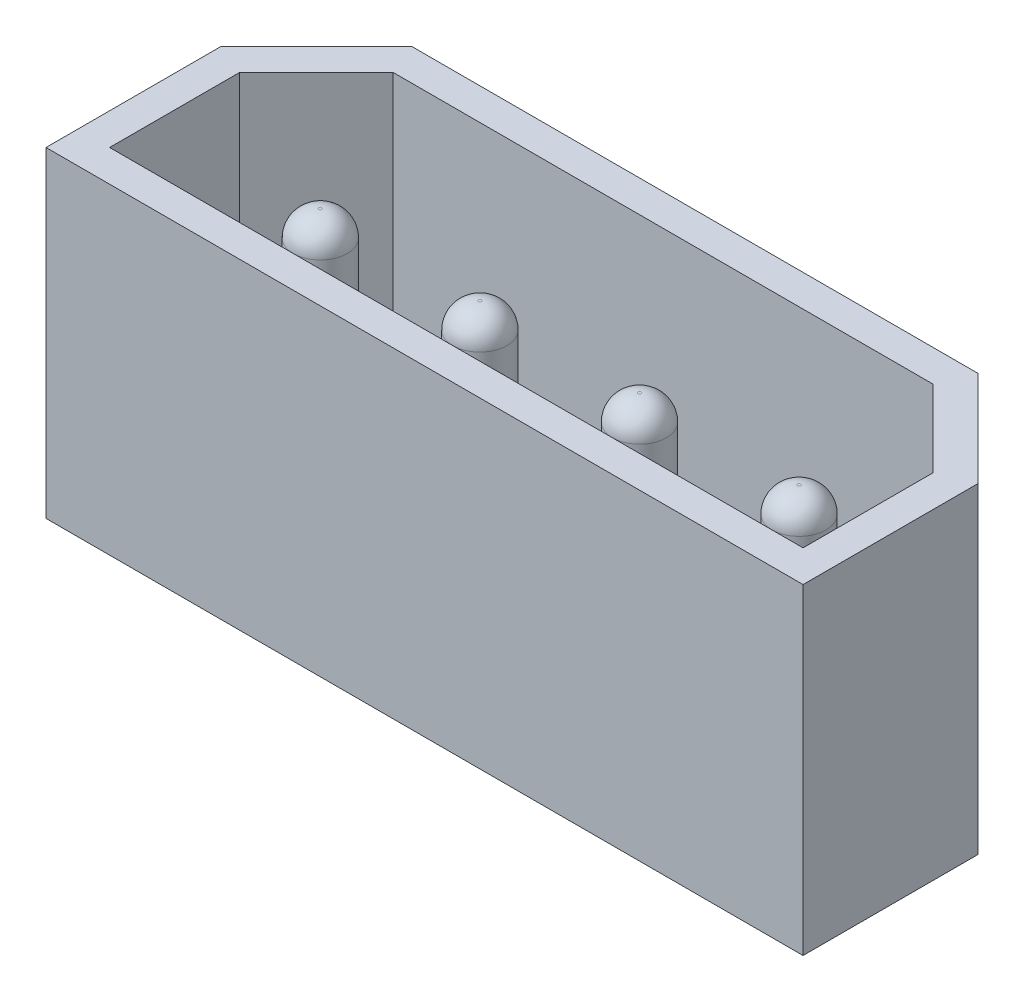
from build123d import *

# Parameters (mm, degrees)
BOSS_EXTRUDE1_DEPTH      = 10.1
SHELL1_T                 = -1
BOSS_EXTRUDE2_DEPTH      = 7.5
BOSS_EXTRUDE2_DEPTH_BACK = 4
SKETCH3_R                = 0.85
FILLET2_R                = 0.8
SKETCH4_W                = 26.621777211
SKETCH4_H                = 1.6
CUT_EXTRUDE1_DEPTH       = 0.8


with BuildPart() as part:
    # Sketch2 → Boss-Extrude1 (new body)
    with BuildSketch(Plane(origin=(0, 0, 0), x_dir=(1, 0, 0), z_dir=(0, 1, 0))):
        Polygon((-11.9, 1.25), (-8.9, 4.25), (8.9, 4.25), (11.9, 1.25), (11.9, -4.25), (-11.9, -4.25), align=None)
    extrude(amount=BOSS_EXTRUDE1_DEPTH)

    # Shell1
    shell1_openings = [part.faces().sort_by_distance(p)[0] for p in [
        (0, 10.1, 0.151319193),
    ]]
    offset(amount=SHELL1_T, openings=shell1_openings, kind=Kind.INTERSECTION)

    # Sketch3 → Boss-Extrude2 (add, two sides: drawn at the far end of the back side and taken through both)
    with BuildSketch(Plane(origin=(0, 1, 0), x_dir=(1, 0, 0), z_dir=(0, 1, 0)).offset(-BOSS_EXTRUDE2_DEPTH_BACK)):
        with Locations(Location((-7.525, 0, 0), (0, 0, 270))):
            Circle(SKETCH3_R)
        with Locations(Location((-2.50875, 0, 0), (0, 0, 270))):
            Circle(SKETCH3_R)
        with Locations(Location((7.525, 0, 0), (0, 0, 270))):
            Circle(SKETCH3_R)
        with Locations(Location((2.50875, 0, 0), (0, 0, 270))):
            Circle(SKETCH3_R)
    extrude(amount=BOSS_EXTRUDE2_DEPTH + BOSS_EXTRUDE2_DEPTH_BACK)

    # Fillet2
    fillet2_edges = [part.edges().sort_by_distance(p)[0] for p in [
        (-7.525, -3, -0.85),
        (-7.525, 8.5, -0.85),
        (-2.50875, -3, -0.85),
        (-2.50875, 8.5, -0.85),
        (7.525, -3, -0.85),
        (7.525, 8.5, -0.85),
        (2.50875, -3, -0.85),
        (2.50875, 8.5, -0.85),
    ]]
    fillet(fillet2_edges, radius=FILLET2_R)

    # Sketch4 → Cut-Extrude1 (cut)
    with BuildSketch(Plane.XZ):
        with Locations((1.142747193, -2.65)):
            Rectangle(SKETCH4_W, SKETCH4_H)
    extrude(amount=-CUT_EXTRUDE1_DEPTH, mode=Mode.SUBTRACT)


solid = part.part
